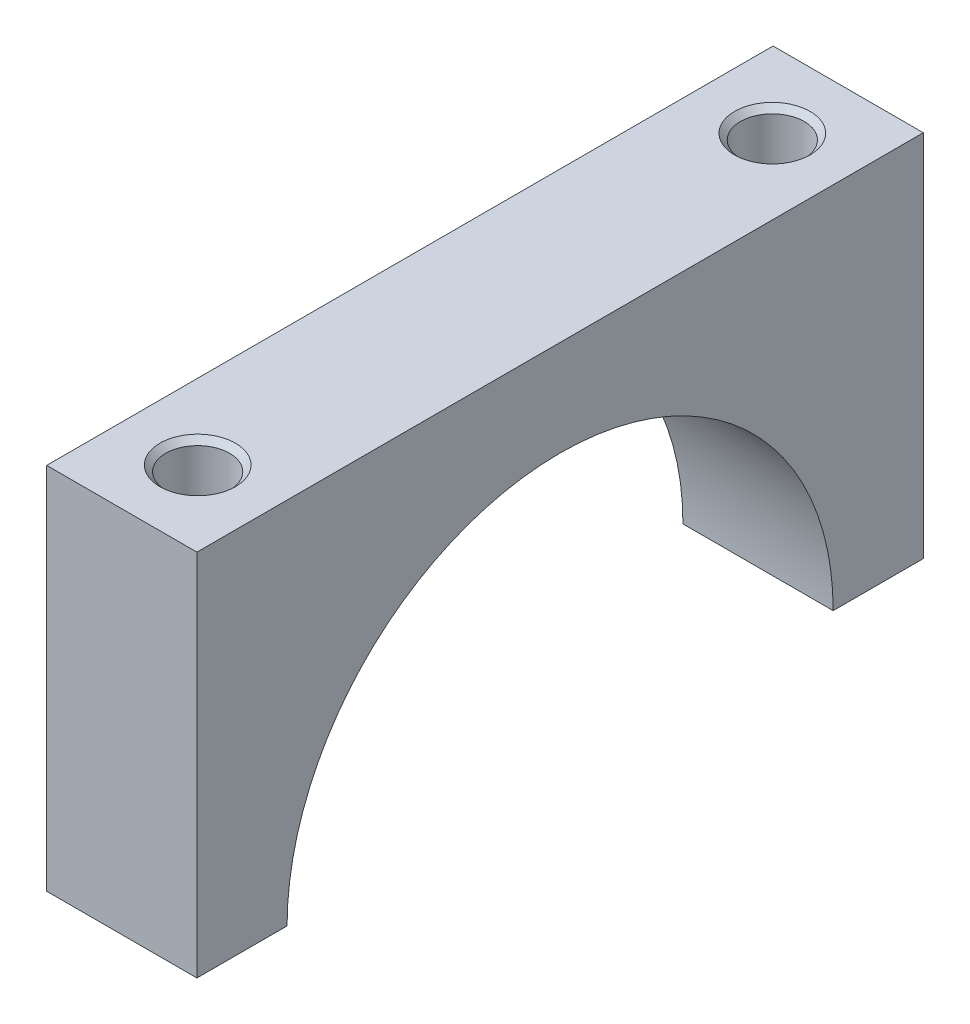
from build123d import *

# Parameters (mm, degrees)
BOSS_EXTRUDE1_DEPTH          = 20
M8_TAPPED_HOLE1_D            = 6.8
M8_TAPPED_HOLE1_DEPTH        = 30
M8_TAPPED_HOLE1_CSINK_D      = 8.05
M8_TAPPED_HOLE1_CSINK_ANGLE  = 90
M8_TAPPED_HOLE1_TIP          = 2.042926105
M10_TAPPED_HOLE1_D           = 8.5
M10_TAPPED_HOLE1_DEPTH       = 27.5
M10_TAPPED_HOLE1_CSINK_D     = 10.05
M10_TAPPED_HOLE1_CSINK_ANGLE = 90
M10_TAPPED_HOLE1_TIP         = 2.553657631


with BuildPart() as part:
    # Sketch1 → Boss-Extrude1 (new body)
    with BuildSketch(Plane(origin=(0, 0, 0), x_dir=(0, 0, -1), z_dir=(1, 0, 0))):
        with BuildLine():
            Line((-48.35, 0), (48.35, 0))
            Line((48.35, 0), (48.35, -49.098))
            Line((48.35, -49.098), (36.35, -49.098))
            ThreePointArc((36.35, -49.098), (0, -12.748), (-36.35, -49.098))
            Line((-36.35, -49.098), (-48.35, -49.098))
            Line((-48.35, -49.098), (-48.35, 0))
        make_face()
    extrude(amount=BOSS_EXTRUDE1_DEPTH)

    # M8 Tapped Hole1
    with Locations(Plane(origin=(0, -49.098, 0), x_dir=(-1, 0, 0), z_dir=(0, -1, 0))):
        with Locations((-10, -42.35), (-10, 42.35)):
            CounterSinkHole(M8_TAPPED_HOLE1_D / 2, M8_TAPPED_HOLE1_CSINK_D / 2, depth=M8_TAPPED_HOLE1_DEPTH, counter_sink_angle=M8_TAPPED_HOLE1_CSINK_ANGLE)
            with Locations((0, 0, -(M8_TAPPED_HOLE1_DEPTH + M8_TAPPED_HOLE1_TIP / 2))):  # 118° drill point
                Cone(0, M8_TAPPED_HOLE1_D / 2, M8_TAPPED_HOLE1_TIP, mode=Mode.SUBTRACT)

    # M10 Tapped Hole1
    with Locations(Plane(origin=(0, 0, 0), x_dir=(1, 0, 0), z_dir=(0, 1, 0))):
        with Locations((10, -38.25), (10, 38.25)):
            CounterSinkHole(M10_TAPPED_HOLE1_D / 2, M10_TAPPED_HOLE1_CSINK_D / 2, depth=M10_TAPPED_HOLE1_DEPTH, counter_sink_angle=M10_TAPPED_HOLE1_CSINK_ANGLE)
            with Locations((0, 0, -(M10_TAPPED_HOLE1_DEPTH + M10_TAPPED_HOLE1_TIP / 2))):  # 118° drill point
                Cone(0, M10_TAPPED_HOLE1_D / 2, M10_TAPPED_HOLE1_TIP, mode=Mode.SUBTRACT)


solid = part.part
